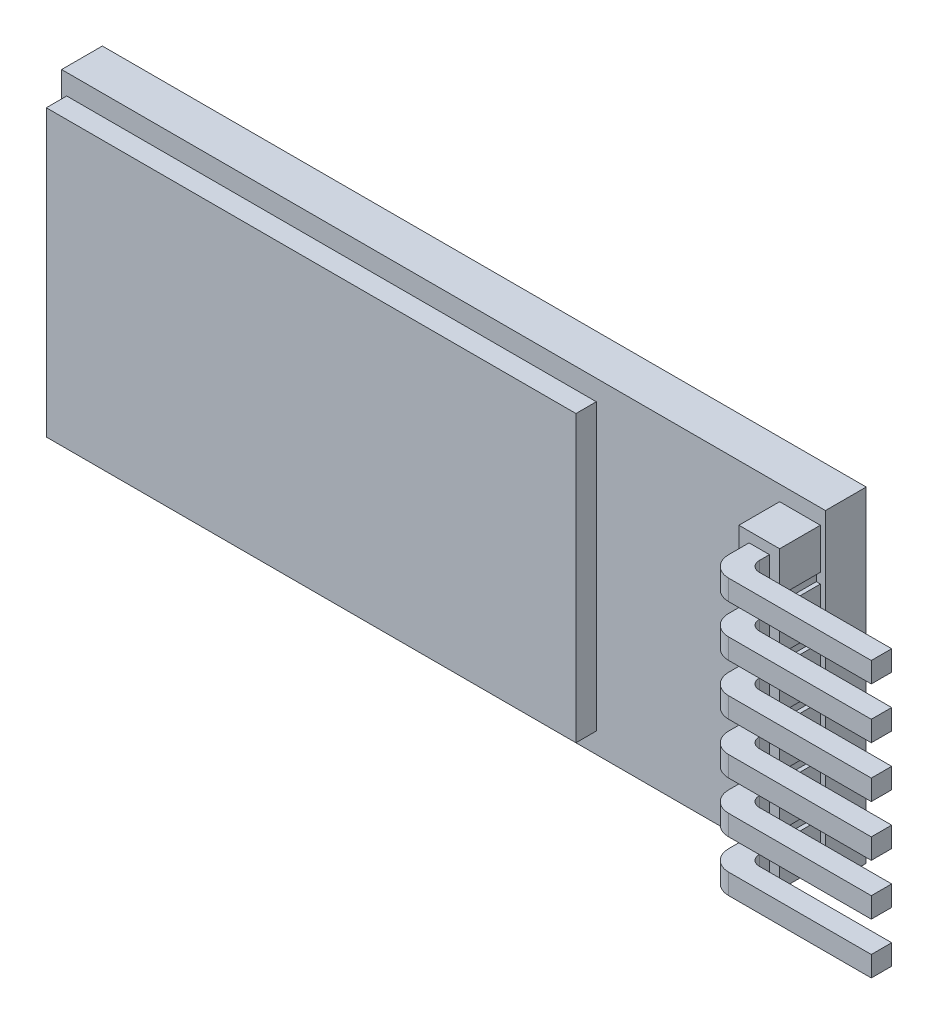
from build123d import *

# Parameters (mm, degrees)
SKETCH1_W                = 37.5
SKETCH1_H                = 16
BOSS_EXTRUDE1_DEPTH      = 2
SKETCH2_W                = 26
SKETCH2_H                = 14
BOSS_EXTRUDE2_DEPTH      = 1
BOSS_EXTRUDE3_DEPTH      = 2
BOSS_EXTRUDE4_DEPTH      = 6.75
BOSS_EXTRUDE4_DEPTH_BACK = 6.75
CUT_EXTRUDE1_DEPTH       = 27.925824036
CUT_EXTRUDE1_DEPTH_BACK  = 27.925824036
SKETCH5_W                = 2
SKETCH5_H                = 1.5


with BuildPart() as part:
    # Sketch1 → Boss-Extrude1 (new body)
    with BuildSketch(Plane.XY):
        Rectangle(SKETCH1_W, SKETCH1_H)
    extrude(amount=BOSS_EXTRUDE1_DEPTH)

    # Sketch2 → Boss-Extrude2 (add)
    with BuildSketch(Plane.XY.offset(2)):
        with Locations((-5.5, 0)):
            Rectangle(SKETCH2_W, SKETCH2_H)
    extrude(amount=BOSS_EXTRUDE2_DEPTH)

    # Sketch3 → Boss-Extrude3 (add)
    with BuildSketch(Plane.XY.offset(2)):
        Polygon((18.3, -5.25), (18.5, -5.25), (18.5, -7.25), (16.5, -7.25), (16.5, -5.25), (16.7, -5.25), (16.7, -4.75), (16.5, -4.75), (16.5, -2.75), (16.7, -2.75), (16.7, -2.25), (16.5, -2.25), (16.5, -0.25), (16.7, -0.25), (16.7, 0.25), (16.5, 0.25), (16.5, 2.25), (16.7, 2.25), (16.7, 2.75), (16.5, 2.75), (16.5, 4.75), (16.7, 4.75), (16.7, 5.25), (16.5, 5.25), (16.5, 7.25), (18.5, 7.25), (18.5, 5.25), (18.3, 5.25), (18.3, 4.75), (18.5, 4.75), (18.5, 2.75), (18.3, 2.75), (18.3, 2.25), (18.5, 2.25), (18.5, 0.25), (18.3, 0.25), (18.3, -0.25), (18.5, -0.25), (18.5, -2.25), (18.3, -2.25), (18.3, -2.75), (18.5, -2.75), (18.5, -4.75), (18.3, -4.75), align=None)
    extrude(amount=BOSS_EXTRUDE3_DEPTH)

    # Sketch4 → Boss-Extrude4 (add, two sides: drawn at the far end of the back side and taken through both)
    with BuildSketch(Plane(origin=(0, 0, 0), x_dir=(1, 0, 0), z_dir=(0, 1, 0)).offset(-BOSS_EXTRUDE4_DEPTH_BACK)):
        with BuildLine():
            Line((17, -4), (17, -5))
            ThreePointArc((17, -5), (17.292893219, -5.707106781), (18, -6))
            Line((18, -6), (25, -6))
            Line((25, -6), (25, -5))
            Line((25, -5), (18.5, -5))
            ThreePointArc((18.5, -5), (18.146446609, -4.853553391), (18, -4.5))
            Line((18, -4.5), (18, -4))
            Line((18, -4), (17, -4))
        make_face()
    extrude(amount=BOSS_EXTRUDE4_DEPTH + BOSS_EXTRUDE4_DEPTH_BACK)

    # Sketch5 → Cut-Extrude1 (cut, two sides: drawn at the far end of the back side and taken through both)
    with BuildSketch(Plane(origin=(0, 0, 0), x_dir=(0, 0, -1), z_dir=(1, 0, 0)).offset(-CUT_EXTRUDE1_DEPTH_BACK)):
        with Locations((-5, -5)):
            Rectangle(SKETCH5_W, SKETCH5_H)
        with Locations((-5, -2.5)):
            Rectangle(SKETCH5_W, SKETCH5_H)
        with Locations((-5, 0)):
            Rectangle(SKETCH5_W, SKETCH5_H)
        with Locations((-5, 2.5)):
            Rectangle(SKETCH5_W, SKETCH5_H)
        with Locations((-5, 5)):
            Rectangle(SKETCH5_W, SKETCH5_H)
    extrude(amount=CUT_EXTRUDE1_DEPTH + CUT_EXTRUDE1_DEPTH_BACK, mode=Mode.SUBTRACT)


solid = part.part
